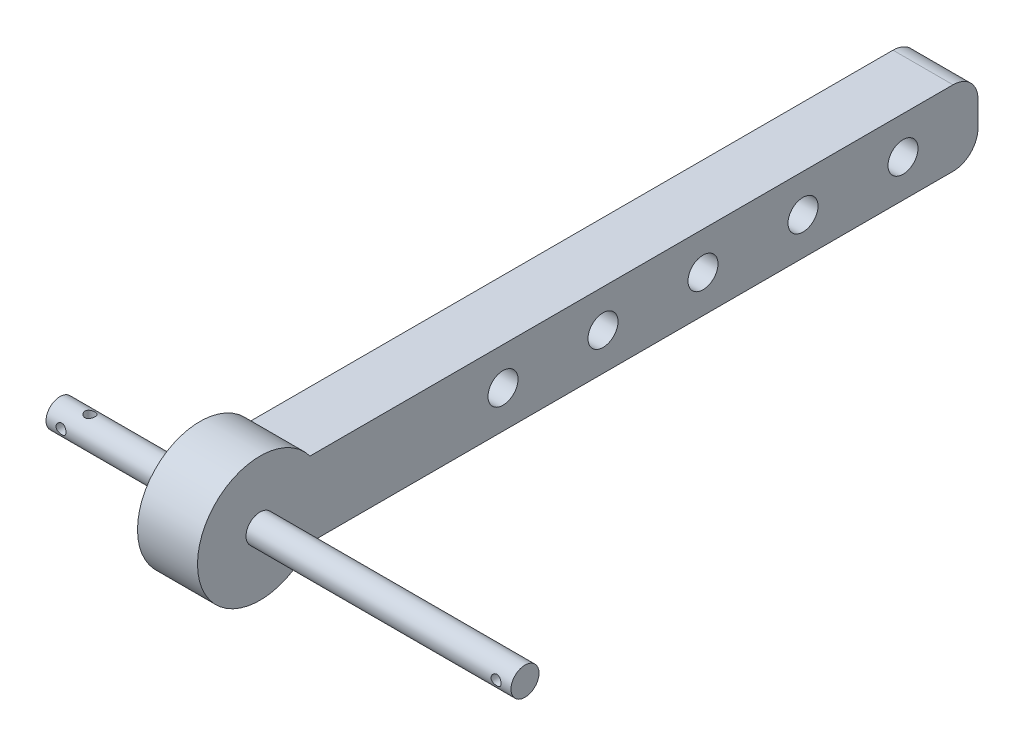
from build123d import *

# Parameters (mm, degrees)
SKETCH_1_W           = 150
SKETCH_1_H           = 15
EXTRUDE_1_DEPTH      = 12
FILLET_1_R           = 5
SKETCH_6_R           = 12.5
EXTRUDE_2_DEPTH      = 12
EXTRUDE_5_DEPTH      = 28
EXTRUDE_5_DEPTH_BACK = 65
SKETCH_15_R          = 2.8
CUT_EXTRUDE_9_REACH  = 166.697
SKETCH_16_R          = 1
CUT_EXTRUDE_10_REACH = 166.697
SKETCH_17_R          = 3
SKETCH_18_R          = 1
CUT_EXTRUDE_11_DEPTH = 15


with BuildPart() as part:
    # 草图1 → 凸台-拉伸1 (new body)
    with BuildSketch(Plane(origin=(0, 0, 0), x_dir=(0, 0, -1), z_dir=(1, 0, 0))):
        with Locations((75, 7.5)):
            Rectangle(SKETCH_1_W, SKETCH_1_H)
    extrude(amount=EXTRUDE_1_DEPTH)

    # 圆角1
    fillet_1_edges = [part.edges().sort_by_distance(p)[0] for p in [
        (6, 15, 0),
        (6, 15, -150),
        (6, 0, -150),
        (6, 0, 0),
    ]]
    fillet(fillet_1_edges, radius=FILLET_1_R)

    # 草图6 → 凸台-拉伸2 (add)
    with BuildSketch(Plane(origin=(12, 0, 0), x_dir=(0, 0, -1), z_dir=(1, 0, 0))):
        with Locations((6.4, 7.5)):
            Circle(SKETCH_6_R)
    extrude(amount=-EXTRUDE_2_DEPTH)

    # 草图15 → 凸台-拉伸5 (add, two sides: drawn at the far end of the back side and taken through both)
    with BuildSketch(Plane.ZY.offset(-EXTRUDE_5_DEPTH_BACK)):
        with Locations((-6.4, 7.5)):
            Circle(SKETCH_15_R)
    extrude(amount=EXTRUDE_5_DEPTH + EXTRUDE_5_DEPTH_BACK)

    # 草图16 → 切除-拉伸9 (cut, up to next)
    with BuildSketch(Plane.XY, mode=Mode.PRIVATE) as cut_extrude_9_sk1:
        with Locations((-25, 7.5)):
            Circle(SKETCH_16_R)
    cut_extrude_9_tool1 = extrude(cut_extrude_9_sk1.sketch, amount=-CUT_EXTRUDE_9_REACH, mode=Mode.PRIVATE) & part.part
    # 草图16 → 切除-拉伸9 (cut, up to next)
    with BuildSketch(Plane.XY, mode=Mode.PRIVATE) as cut_extrude_9_sk2:
        with Locations((62, 7.5)):
            Circle(SKETCH_16_R)
    cut_extrude_9_tool2 = extrude(cut_extrude_9_sk2.sketch, amount=-CUT_EXTRUDE_9_REACH, mode=Mode.PRIVATE) & part.part
    add(cut_extrude_9_tool1.solids().sort_by_distance((-25, 7.5, 0))[0], mode=Mode.SUBTRACT)
    add(cut_extrude_9_tool2.solids().sort_by_distance((62, 7.5, 0))[0], mode=Mode.SUBTRACT)

    # 草图17 → 切除-拉伸10 (cut, up to next)
    with BuildSketch(Plane.ZY, mode=Mode.PRIVATE) as cut_extrude_10_sk1:
        with Locations((-135, 7.5)):
            Circle(SKETCH_17_R)
    cut_extrude_10_tool1 = extrude(cut_extrude_10_sk1.sketch, amount=-CUT_EXTRUDE_10_REACH, mode=Mode.PRIVATE) & part.part
    # 草图17 → 切除-拉伸10 (cut, up to next)
    with BuildSketch(Plane.ZY, mode=Mode.PRIVATE) as cut_extrude_10_sk2:
        with Locations((-115, 7.5)):
            Circle(SKETCH_17_R)
    cut_extrude_10_tool2 = extrude(cut_extrude_10_sk2.sketch, amount=-CUT_EXTRUDE_10_REACH, mode=Mode.PRIVATE) & part.part
    # 草图17 → 切除-拉伸10 (cut, up to next)
    with BuildSketch(Plane.ZY, mode=Mode.PRIVATE) as cut_extrude_10_sk3:
        with Locations((-95, 7.5)):
            Circle(SKETCH_17_R)
    cut_extrude_10_tool3 = extrude(cut_extrude_10_sk3.sketch, amount=-CUT_EXTRUDE_10_REACH, mode=Mode.PRIVATE) & part.part
    # 草图17 → 切除-拉伸10 (cut, up to next)
    with BuildSketch(Plane.ZY, mode=Mode.PRIVATE) as cut_extrude_10_sk4:
        with Locations((-75, 7.5)):
            Circle(SKETCH_17_R)
    cut_extrude_10_tool4 = extrude(cut_extrude_10_sk4.sketch, amount=-CUT_EXTRUDE_10_REACH, mode=Mode.PRIVATE) & part.part
    # 草图17 → 切除-拉伸10 (cut, up to next)
    with BuildSketch(Plane.ZY, mode=Mode.PRIVATE) as cut_extrude_10_sk5:
        with Locations((-55, 7.5)):
            Circle(SKETCH_17_R)
    cut_extrude_10_tool5 = extrude(cut_extrude_10_sk5.sketch, amount=-CUT_EXTRUDE_10_REACH, mode=Mode.PRIVATE) & part.part
    add(cut_extrude_10_tool1.solids().sort_by_distance((0, 7.5, -135))[0], mode=Mode.SUBTRACT)
    add(cut_extrude_10_tool2.solids().sort_by_distance((0, 7.5, -115))[0], mode=Mode.SUBTRACT)
    add(cut_extrude_10_tool3.solids().sort_by_distance((0, 7.5, -95))[0], mode=Mode.SUBTRACT)
    add(cut_extrude_10_tool4.solids().sort_by_distance((0, 7.5, -75))[0], mode=Mode.SUBTRACT)
    add(cut_extrude_10_tool5.solids().sort_by_distance((0, 7.5, -55))[0], mode=Mode.SUBTRACT)

    # 草图18 → 切除-拉伸11 (cut)
    with BuildSketch(Plane(origin=(0, 0, 0), x_dir=(1, 0, 0), z_dir=(0, 1, 0))):
        with Locations(Location((-22, 6.4, 0), (0, 0, 90))):
            Circle(SKETCH_18_R)
    extrude(amount=CUT_EXTRUDE_11_DEPTH, mode=Mode.SUBTRACT)


solid = part.part
